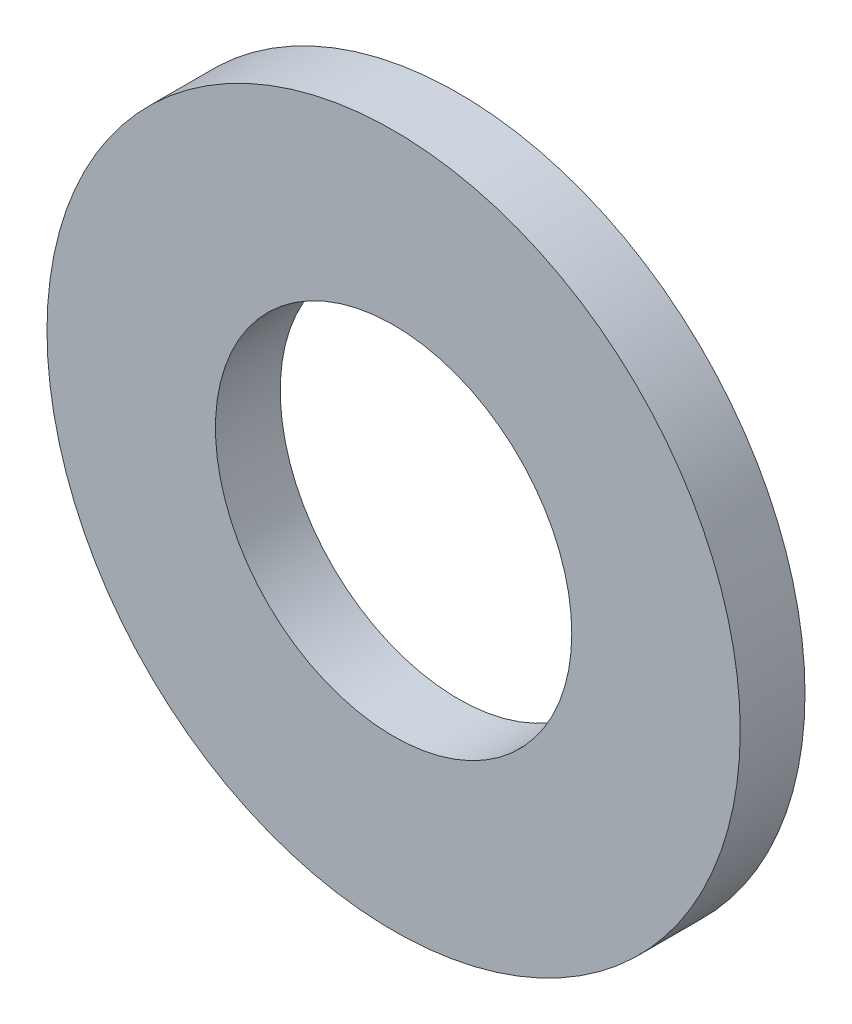
from build123d import *

# Parameters (mm, degrees)
SKETCH1_R           = 5.35
SKETCH1_R_2         = 2.75
BOSS_EXTRUDE1_DEPTH = 1


with BuildPart() as part:
    # Sketch1 → Boss-Extrude1 (new body)
    with BuildSketch(Plane.XY):
        Circle(SKETCH1_R)
        Circle(SKETCH1_R_2, mode=Mode.SUBTRACT)
    extrude(amount=BOSS_EXTRUDE1_DEPTH)


solid = part.part
